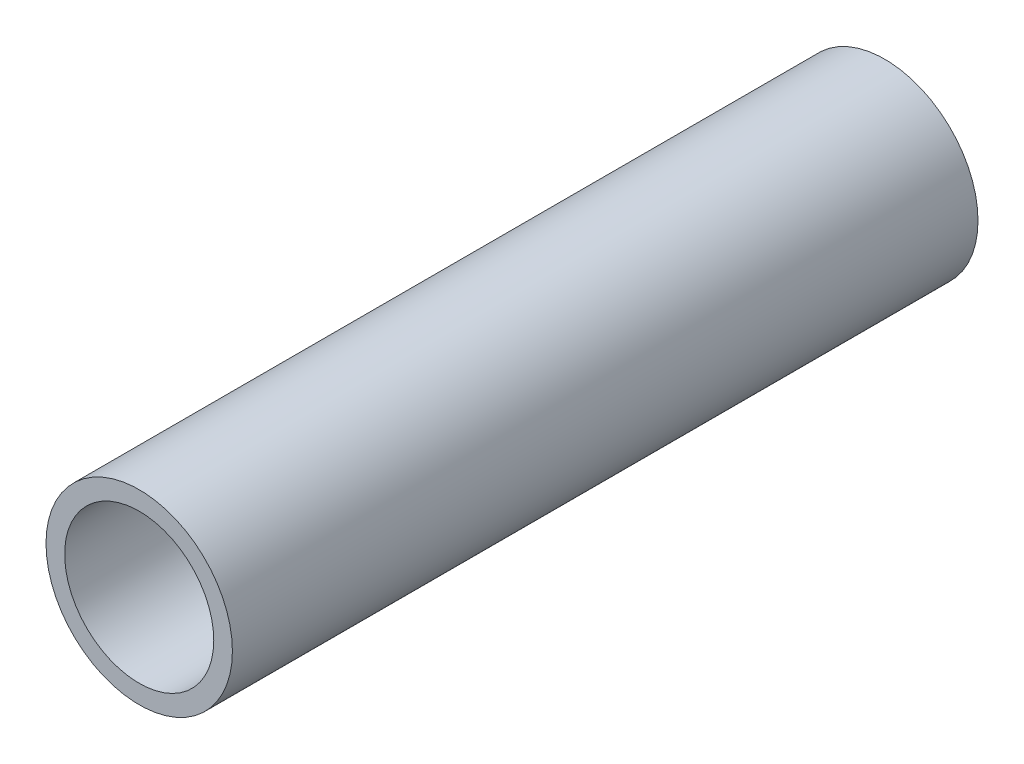
from build123d import *

# Parameters (mm, degrees)
ESBO_O1_R                = 12.5
ESBO_O1_R_2              = 10
RESSALTO_EXTRUS_O1_DEPTH = 100


with BuildPart() as part:
    # Esboço1 → Ressalto-extrusão1 (new body)
    with BuildSketch(Plane.XY):
        Circle(ESBO_O1_R)
        Circle(ESBO_O1_R_2, mode=Mode.SUBTRACT)
    extrude(amount=RESSALTO_EXTRUS_O1_DEPTH)


solid = part.part
